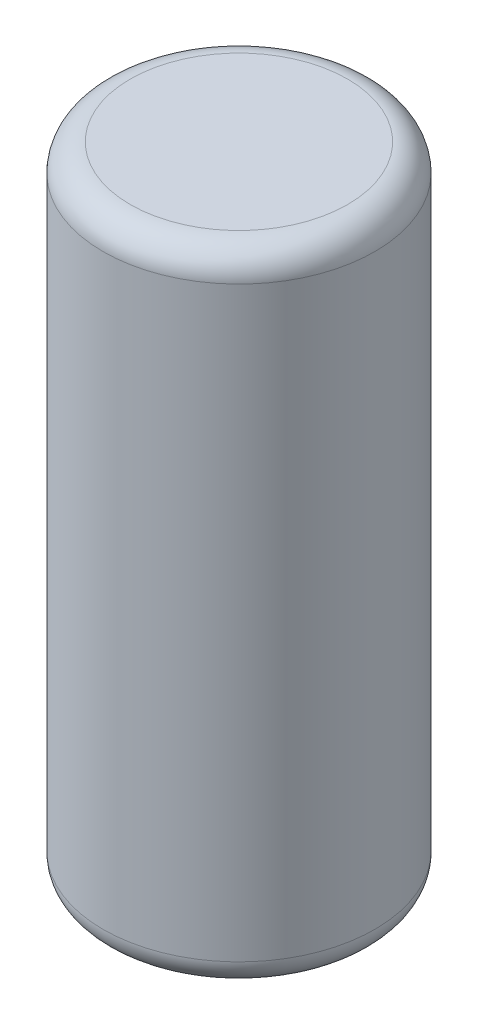
from build123d import *


with BuildPart() as part:
    # 草圖1 → 旋轉1 (revolve)
    with BuildSketch(Plane(origin=(0, 0, 0), x_dir=(-1, 0, 0), z_dir=(0, 0, -1)), mode=Mode.PRIVATE) as revolve_1_sk:
        with BuildLine():
            Line((-2, 0), (0, 0))
            Line((0, 0), (0, 11.8))
            Line((0, 11.8), (-2, 11.8))
            ThreePointArc((-2, 11.8), (-2.353553391, 11.653553391), (-2.5, 11.3))
            Line((-2.5, 11.3), (-2.5, 0.5))
            ThreePointArc((-2.5, 0.5), (-2.353553391, 0.146446609), (-2, 0))
        make_face()
    revolve(revolve_1_sk.sketch.rotate(Axis((0, -0.002193579, 0), (0, 1, 0)), 270), axis=Axis((0, -0.002193579, 0), (0, 1, 0)))


solid = part.part
